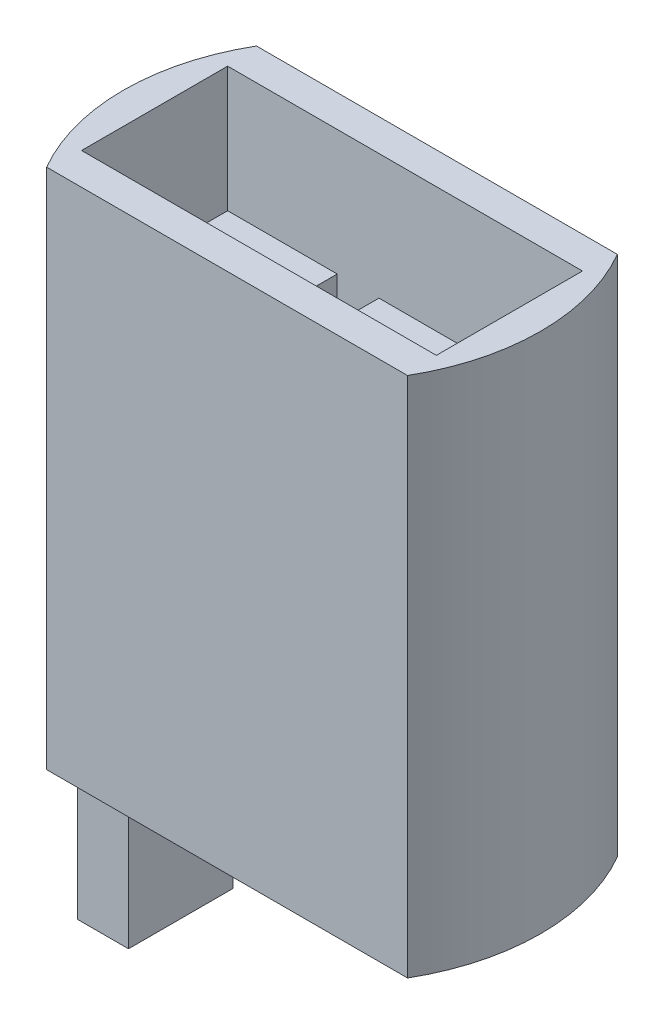
from build123d import *

# Parameters (mm, degrees)
SKETCH1_R           = 10
BOSS_EXTRUDE1_DEPTH = 25
SKETCH2_W           = 0.8
SKETCH2_H           = 5
BOSS_EXTRUDE2_DEPTH = 8
BOSS_EXTRUDE3_DEPTH = 1.2
SKETCH4_W           = 17
SKETCH4_H           = 7
CUT_EXTRUDE1_DEPTH  = 6
SKETCH5_W           = 2
SKETCH5_H           = 7
CUT_EXTRUDE2_DEPTH  = 4
CUT_EXTRUDE3_DEPTH  = 25
SKETCH7_W           = 5
SKETCH7_H           = 8
BOSS_EXTRUDE4_DEPTH = 0.8
CUT_EXTRUDE4_REACH  = 29.409


with BuildPart() as part:
    # Sketch1 → Boss-Extrude1 (new body)
    with BuildSketch(Plane(origin=(0, 0, 0), x_dir=(1, 0, 0), z_dir=(0, 1, 0))):
        with Locations(Location((0, 0, 0), (0, 0, 270))):
            Circle(SKETCH1_R)
    extrude(amount=BOSS_EXTRUDE1_DEPTH)

    # Sketch4 → Cut-Extrude1 (cut)
    with BuildSketch(Plane(origin=(0, 25, 0), x_dir=(1, 0, 0), z_dir=(0, 1, 0))):
        Rectangle(SKETCH4_W, SKETCH4_H)
    extrude(amount=-CUT_EXTRUDE1_DEPTH, mode=Mode.SUBTRACT)

    # Sketch5 → Cut-Extrude2 (cut)
    with BuildSketch(Plane(origin=(0, 19, 0), x_dir=(1, 0, 0), z_dir=(0, 1, 0))):
        with Locations((-2.25, 0)):
            Rectangle(SKETCH5_W, SKETCH5_H)
    extrude(amount=-CUT_EXTRUDE2_DEPTH, mode=Mode.SUBTRACT)

    # Sketch6 → Cut-Extrude3 (cut)
    with BuildSketch(Plane.XZ):
        with BuildLine():
            Line((-8.644632716, 5.026959838), (8.644632716, 5.026959838))
            ThreePointArc((8.644632716, 5.026959838), (0, 10), (-8.644632716, 5.026959838))
        make_face()
        with BuildLine():
            Line((-8.644632716, -5.026959838), (8.644632716, -5.026959838))
            ThreePointArc((8.644632716, -5.026959838), (0, -10), (-8.644632716, -5.026959838))
        make_face()
    extrude(amount=-CUT_EXTRUDE3_DEPTH, mode=Mode.SUBTRACT)



with BuildPart() as body_2:
    # Sketch2 → Boss-Extrude2 (new body)
    with BuildSketch(Plane(origin=(0, 0, 0), x_dir=(-1, 0, 0), z_dir=(0, -1, 0))):
        with Locations((7.65, 0)):
            Rectangle(SKETCH2_W, SKETCH2_H)
    extrude(amount=BOSS_EXTRUDE2_DEPTH)

    # Sketch3 → Boss-Extrude3 (add)
    with BuildSketch(Plane.ZY.offset(8.05)):
        Polygon((-2.5, -8), (-2.5, 0), (2.5, 0), (2.5, -8), (1.5, -8), (1.5, -0.75), (-1.5, -0.75), (-1.5, -8), align=None)
    extrude(amount=BOSS_EXTRUDE3_DEPTH)


with BuildPart() as part_1:
    add(part.part)

    add(body_2.part)  # Boss-Extrude4 merges body 2
    # Sketch7 → Boss-Extrude4 (add)
    with BuildSketch(Plane.ZY.offset(9.25)):
        with Locations((0, -4)):
            Rectangle(SKETCH7_W, SKETCH7_H)
    extrude(amount=BOSS_EXTRUDE4_DEPTH)

    # Sketch8 → Cut-Extrude4 (cut, up to next)
    with BuildSketch(Plane(origin=(0, 0, 0), x_dir=(1, 0, 0), z_dir=(0, 1, 0)), mode=Mode.PRIVATE) as cut_extrude4_sk1:
        with BuildLine():
            Line((-9.682458366, 2.5), (-10.05, 2.5))
            Line((-10.05, 2.5), (-10.05, -2.5))
            Line((-10.05, -2.5), (-9.682458366, -2.5))
            ThreePointArc((-9.682458366, -2.5), (-10, 0), (-9.682458366, 2.5))
        make_face()
    cut_extrude4_tool1 = extrude(cut_extrude4_sk1.sketch, amount=-CUT_EXTRUDE4_REACH, mode=Mode.PRIVATE) & part_1.part
    add(cut_extrude4_tool1.solids().sort_by_distance((-9.866229, 0, -2.449865))[0], mode=Mode.SUBTRACT)


solid = part_1.part
